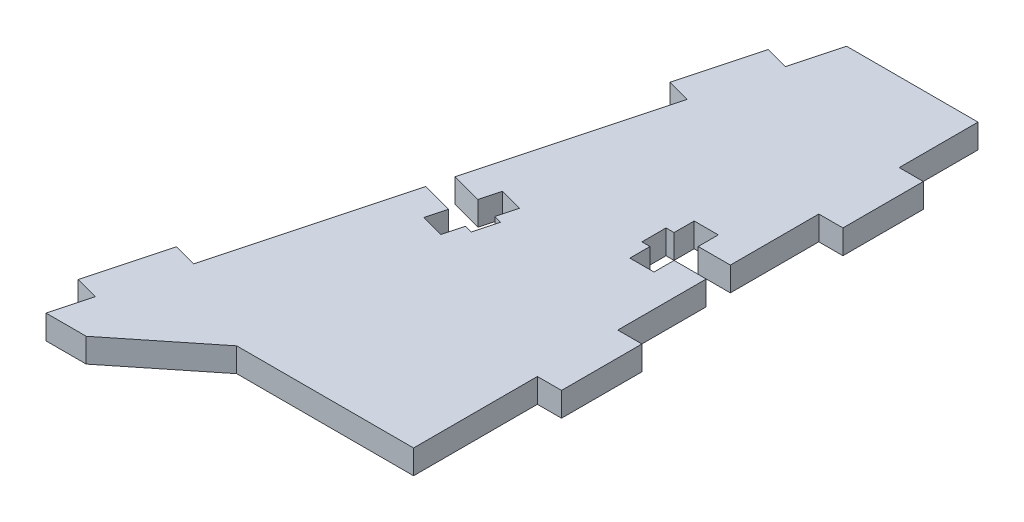
from build123d import *

# Parameters (mm, degrees)
SALIENTE_EXTRUIR1_DEPTH = 3


with BuildPart() as part:
    # Croquis1 → Saliente-Extruir1 (new body)
    with BuildSketch(Plane(origin=(0, 0, 0), x_dir=(1, 0, 0), z_dir=(0, 1, 0))):
        Polygon((33650.139555681, 12767.282956749), (33650.139555681, 12775.055328636), (33650.139555681, 12775.328617453), (33650.139555681, 12777.282956749), (33647.139555681, 12777.282956749), (33647.139555681, 12787.082885849), (33635.94578982, 12787.082885849), (33635.671837895, 12787.082885849), (33630.789720544, 12787.082885849), (33629.183977771, 12781.090172235), (33626.286200294, 12781.86662937), (33624.573845764, 12775.476035262), (33624.496637954, 12775.187891792), (33623.698009844, 12772.207371113), (33626.595787322, 12771.430913979), (33620.501434111, 12748.686478159), (33624.365137417, 12747.651201979), (33625.012185029, 12750.066016545), (33627.909962508, 12749.289559409), (33627.262914895, 12746.874744843), (33628.228840722, 12746.615925798), (33627.452383586, 12743.71814832), (33626.48645776, 12743.976967365), (33625.839410147, 12741.562152799), (33622.941632669, 12742.338609934), (33623.588680281, 12744.7534245), (33619.724976976, 12745.78870068), (33617.514949698, 12737.54076659), (33617.437149855, 12737.250413623), (33613.631082559, 12723.0459771), (33610.733305082, 12723.822434235), (33608.145114633, 12714.163175978), (33611.04289211, 12713.386718843), (33609.748796885, 12708.557089715), (33614.748796882, 12708.557089715), (33625.139555681, 12716.882956749), (33636.140100097, 12716.882956749), (33636.430328962, 12716.882956749), (33647.139555681, 12716.882956749), (33647.139555681, 12732.282956749), (33650.139555681, 12732.282956749), (33650.139555681, 12737.081355867), (33650.139555681, 12737.35264555), (33650.139555681, 12742.282956749), (33647.139555681, 12742.282956749), (33647.139555681, 12746.182956749), (33647.139555681, 12749.182956749), (33647.139555681, 12753.282956749), (33643.139555681, 12753.282956749), (33643.139555681, 12750.782956749), (33640.139555681, 12750.782956749), (33640.139555681, 12753.282956749), (33639.139555681, 12753.282956749), (33639.139555681, 12756.282956749), (33640.139555681, 12756.282956749), (33640.139555681, 12758.782956749), (33643.139555681, 12758.782956749), (33643.139555681, 12756.282956749), (33647.139555681, 12756.282956749), (33647.139555681, 12767.282956749), align=None)
    extrude(amount=SALIENTE_EXTRUIR1_DEPTH)


solid = part.part
